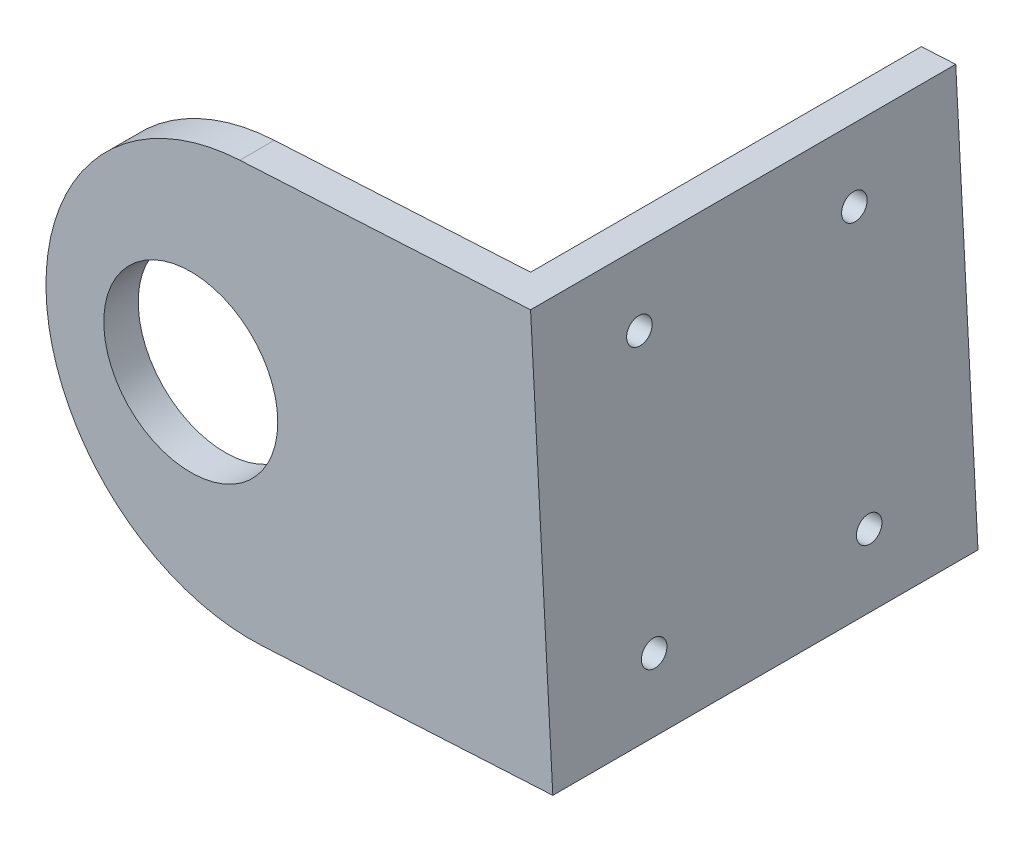
from build123d import *

# Parameters (mm, degrees)
SKETCH1_R           = 12.625
BOSS_EXTRUDE1_DEPTH = 5
SKETCH2_W           = 61.7
SKETCH2_H           = 59.5
SKETCH2_R           = 1.85
BOSS_EXTRUDE2_DEPTH = 5
FILLET1_RADIUS      = 29.75
FILLET1_LENGTH      = 5


with BuildPart() as part:
    # Sketch1 → Boss-Extrude1 (new body)
    with BuildSketch(Plane.XY):
        Polygon((-22.584548564, 28.565725374), (44.316590659, 32.204072605), (47.547660215, -27.208133124), (-19.353479009, -30.846480354), align=None)
        Circle(SKETCH1_R, mode=Mode.SUBTRACT)
    extrude(amount=BOSS_EXTRUDE1_DEPTH)

    # Sketch2 → Boss-Extrude2 (add)
    with BuildSketch(Plane(origin=(45.932125437, 2.49796974, 0), x_dir=(0, 0, -1), z_dir=(0.9985244660253657, 0.05430369001051772, 0))):
        with Locations((25.85, 0)):
            Rectangle(SKETCH2_W, SKETCH2_H)
        with Locations(Location((10.25, 19.75, 0), (0, 0, 90))):
            Circle(SKETCH2_R, mode=Mode.SUBTRACT)
        with Locations(Location((41.45, 19.75, 0), (0, 0, 90))):
            Circle(SKETCH2_R, mode=Mode.SUBTRACT)
        with Locations(Location((41.45, -19.75, 0), (0, 0, 90))):
            Circle(SKETCH2_R, mode=Mode.SUBTRACT)
        with Locations(Location((10.25, -19.75, 0), (0, 0, 90))):
            Circle(SKETCH2_R, mode=Mode.SUBTRACT)
    extrude(amount=BOSS_EXTRUDE2_DEPTH)

    # Fillet1: full round fillet: the end face becomes a half cylinder, R = half its width
    fillet1_face = Plane((-20.969013787, -1.14037749, 2.5), x_dir=(0, 0, -1), z_dir=(-0.998524466025, -0.054303690011, 0))  # on the end face: x along it, z out of the body
    fillet1_slab = fillet1_face.offset(-FILLET1_RADIUS / 2) * Box(FILLET1_LENGTH, 2 * FILLET1_RADIUS, FILLET1_RADIUS, mode=Mode.PRIVATE)  # the body's end, R deep
    fillet1_round = Plane((8.737089077, 0.475157288, 2.5), x_dir=(-0.998524466025, -0.054303690011, 0), z_dir=(0, 0, -1)) * Cylinder(FILLET1_RADIUS, FILLET1_LENGTH, mode=Mode.PRIVATE)  # its axis R under the face
    add(fillet1_slab - fillet1_round, mode=Mode.SUBTRACT)


solid = part.part
